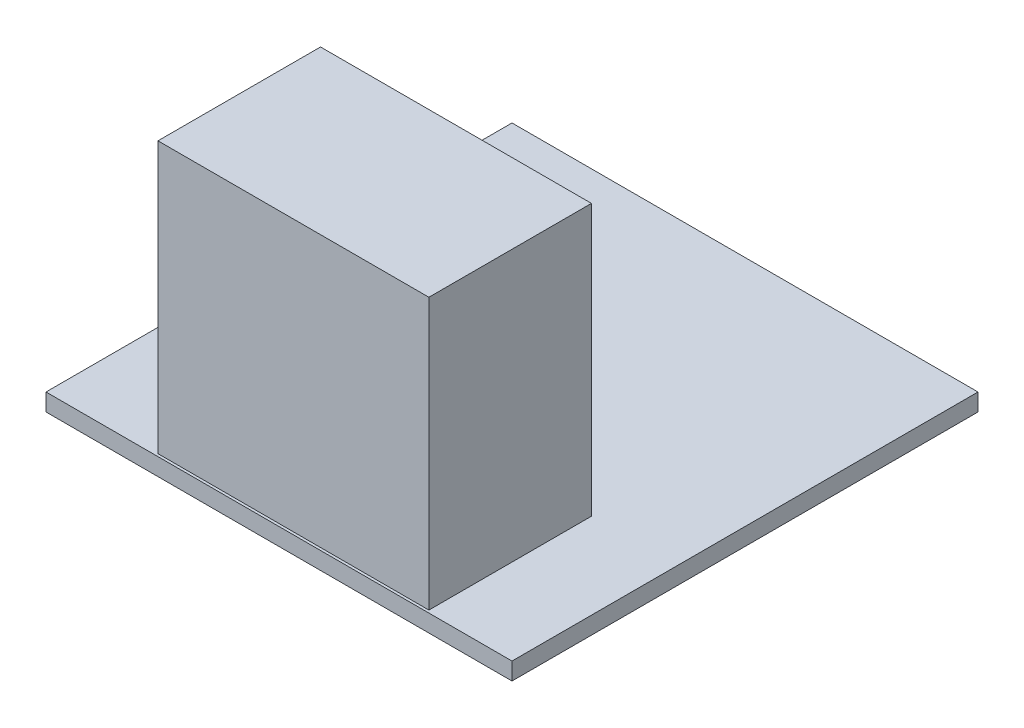
from build123d import *

# Parameters (mm, degrees)
SKETCH1_W           = 43
SKETCH1_H           = 43
BOSS_EXTRUDE1_DEPTH = 1.6
SKETCH2_W           = 25
SKETCH2_H           = 15
BOSS_EXTRUDE2_DEPTH = 25


with BuildPart() as part:
    # Sketch1 → Boss-Extrude1 (new body)
    with BuildSketch(Plane(origin=(0, 0, 0), x_dir=(1, 0, 0), z_dir=(0, 1, 0))):
        with Locations((21.5, 21.5)):
            Rectangle(SKETCH1_W, SKETCH1_H)
    extrude(amount=BOSS_EXTRUDE1_DEPTH)

    # Sketch2 → Boss-Extrude2 (add)
    with BuildSketch(Plane(origin=(0, 1.6, 0), x_dir=(1, 0, 0), z_dir=(0, 1, 0))):
        with Locations((22.594499084, 7.736979321)):
            Rectangle(SKETCH2_W, SKETCH2_H)
    extrude(amount=BOSS_EXTRUDE2_DEPTH)


solid = part.part
